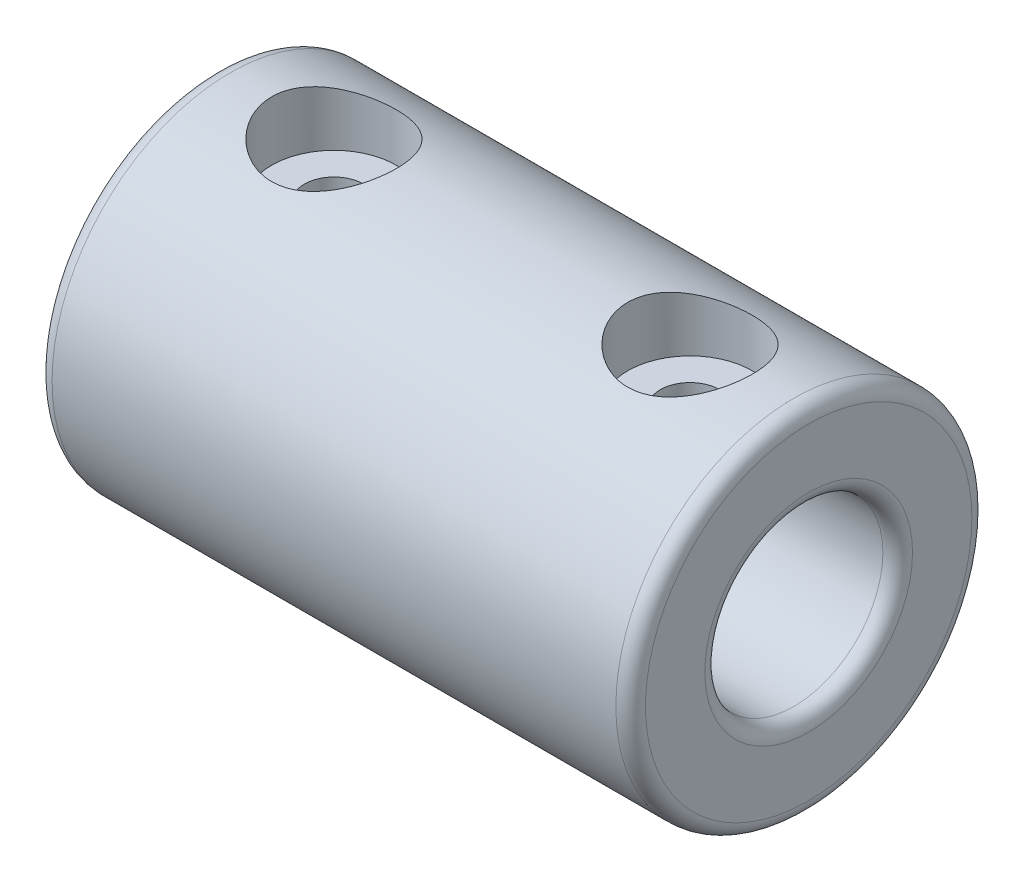
from build123d import *

# Parameters (mm, degrees)
BOSS_EXTRUDE1_DEPTH      = 10
BOSS_EXTRUDE1_DEPTH_BACK = 10
SKETCH1_R                = 6
SKETCH2_R                = 3
CUT_EXTRUDE1_DEPTH       = 10
SKETCH3_R                = 2
CUT_EXTRUDE2_DEPTH       = 10
CUT_EXTRUDE4_REACH       = 15.115
SKETCH4_R                = 1
FILLET1_R                = 0.5
SKETCH5_R                = 2.1
CUT_EXTRUDE7_DEPTH       = 2


with BuildPart() as part:
    # Sketch1 → Boss-Extrude1 (new, two sides: drawn at the far end of the back side and taken through both)
    with BuildSketch(Plane(origin=(0, 0, 0), x_dir=(0, 0, -1), z_dir=(1, 0, 0)).offset(-BOSS_EXTRUDE1_DEPTH_BACK)):
        Circle(SKETCH1_R)
    extrude(amount=BOSS_EXTRUDE1_DEPTH + BOSS_EXTRUDE1_DEPTH_BACK)

    # Sketch2 → Cut-Extrude1 (cut)
    with BuildSketch(Plane(origin=(10, 0, 0), x_dir=(0, 0, -1), z_dir=(1, 0, 0))):
        Circle(SKETCH2_R)
    extrude(amount=-CUT_EXTRUDE1_DEPTH, mode=Mode.SUBTRACT)

    # Sketch3 → Cut-Extrude2 (cut)
    with BuildSketch(Plane.ZY.offset(10)):
        Circle(SKETCH3_R)
    extrude(amount=-CUT_EXTRUDE2_DEPTH, mode=Mode.SUBTRACT)

    # Sketch4 → Cut-Extrude4 (cut, up to next)
    with BuildSketch(Plane(origin=(0, 0, 0), x_dir=(1, 0, 0), z_dir=(0, 1, 0)), mode=Mode.PRIVATE) as cut_extrude4_sk1:
        with Locations((-6, 0)):
            Circle(SKETCH4_R)
    cut_extrude4_tool1 = extrude(cut_extrude4_sk1.sketch, amount=CUT_EXTRUDE4_REACH, mode=Mode.PRIVATE) & part.part
    # Sketch4 → Cut-Extrude4 (cut, up to next)
    with BuildSketch(Plane(origin=(0, 0, 0), x_dir=(1, 0, 0), z_dir=(0, 1, 0)), mode=Mode.PRIVATE) as cut_extrude4_sk2:
        with Locations((6, 0)):
            Circle(SKETCH4_R)
    cut_extrude4_tool2 = extrude(cut_extrude4_sk2.sketch, amount=CUT_EXTRUDE4_REACH, mode=Mode.PRIVATE) & part.part
    add(cut_extrude4_tool1.solids().sort_by_distance((-6, 0, 0))[0], mode=Mode.SUBTRACT)
    add(cut_extrude4_tool2.solids().sort_by_distance((6, 0, 0))[0], mode=Mode.SUBTRACT)

    # Fillet1
    fillet1_edges = [part.edges().sort_by_distance(p)[0] for p in [
        (10, 0, 3),
        (10, 0, 6),
        (-10, 0, 6),
        (-10, 0, -2),
    ]]
    fillet(fillet1_edges, radius=FILLET1_R)

    # Sketch5 → Cut-Extrude7 (cut)
    with BuildSketch(Plane(origin=(0, 6, 0), x_dir=(1, 0, 0), z_dir=(0, 1, 0))):
        with Locations((-6, 0)):
            Circle(SKETCH5_R)
        with Locations((6, 0)):
            Circle(SKETCH5_R)
    extrude(amount=-CUT_EXTRUDE7_DEPTH, mode=Mode.SUBTRACT)


solid = part.part
